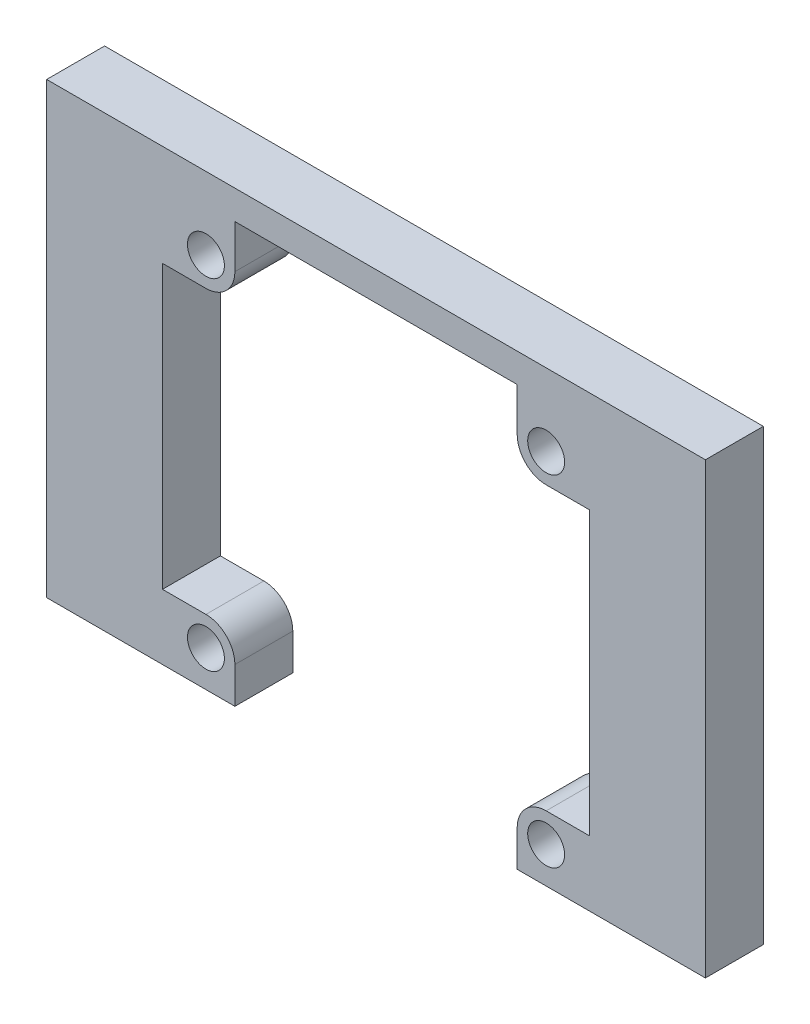
from build123d import *

# Parameters (mm, degrees)
ESQUISSE1_R        = 2.55
BOSS_EXTRU_2_DEPTH = 8


with BuildPart() as part:
    # Esquisse1 → Boss.-Extru.2 (new body)
    with BuildSketch(Plane.XY):
        with BuildLine():
            Line((-45.5, 82.95), (-45.5, 26.95))
            Line((-45.5, 26.95), (-45.5, 25.95))
            Line((-45.5, 25.95), (-19.5, 25.95))
            Line((-19.5, 25.95), (-19.5, 30.95))
            ThreePointArc((-19.5, 30.95), (-20.671572875, 33.778427125), (-23.5, 34.95))
            Line((-23.5, 34.95), (-29.5, 34.95))
            Line((-29.5, 34.95), (-29.5, 73.95))
            Line((-29.5, 73.95), (-23.5, 73.95))
            ThreePointArc((-23.5, 73.95), (-20.671572875, 75.121572875), (-19.5, 77.95))
            Line((-19.5, 77.95), (-19.5, 82.95))
            Line((-19.5, 82.95), (-19.5, 83.95))
            Line((-19.5, 83.95), (-18.5, 83.95))
            Line((-18.5, 83.95), (18.5, 83.95))
            Line((18.5, 83.95), (19.5, 83.95))
            Line((19.5, 83.95), (19.5, 82.95))
            Line((19.5, 82.95), (19.5, 77.95))
            ThreePointArc((19.5, 77.95), (20.671572875, 75.121572875), (23.5, 73.95))
            Line((23.5, 73.95), (29.5, 73.95))
            Line((29.5, 73.95), (29.5, 34.95))
            Line((29.5, 34.95), (23.5, 34.95))
            ThreePointArc((23.5, 34.95), (20.671572875, 33.778427125), (19.5, 30.95))
            Line((19.5, 30.95), (19.5, 25.95))
            Line((19.5, 25.95), (28.5, 25.95))
            Line((28.5, 25.95), (45.5, 25.95))
            Line((45.5, 25.95), (45.5, 26.95))
            Line((45.5, 26.95), (45.5, 82.95))
            Line((45.5, 82.95), (45.5, 87.95))
            Line((45.5, 87.95), (-45.5, 87.95))
            Line((-45.5, 87.95), (-45.5, 82.95))
        make_face()
        with Locations((-23.5, 30.95)):
            Circle(ESQUISSE1_R, mode=Mode.SUBTRACT)
        with Locations((23.5, 30.95)):
            Circle(ESQUISSE1_R, mode=Mode.SUBTRACT)
        with Locations((-23.5, 77.95)):
            Circle(ESQUISSE1_R, mode=Mode.SUBTRACT)
        with Locations((23.5, 77.95)):
            Circle(ESQUISSE1_R, mode=Mode.SUBTRACT)
    extrude(amount=BOSS_EXTRU_2_DEPTH)


solid = part.part
